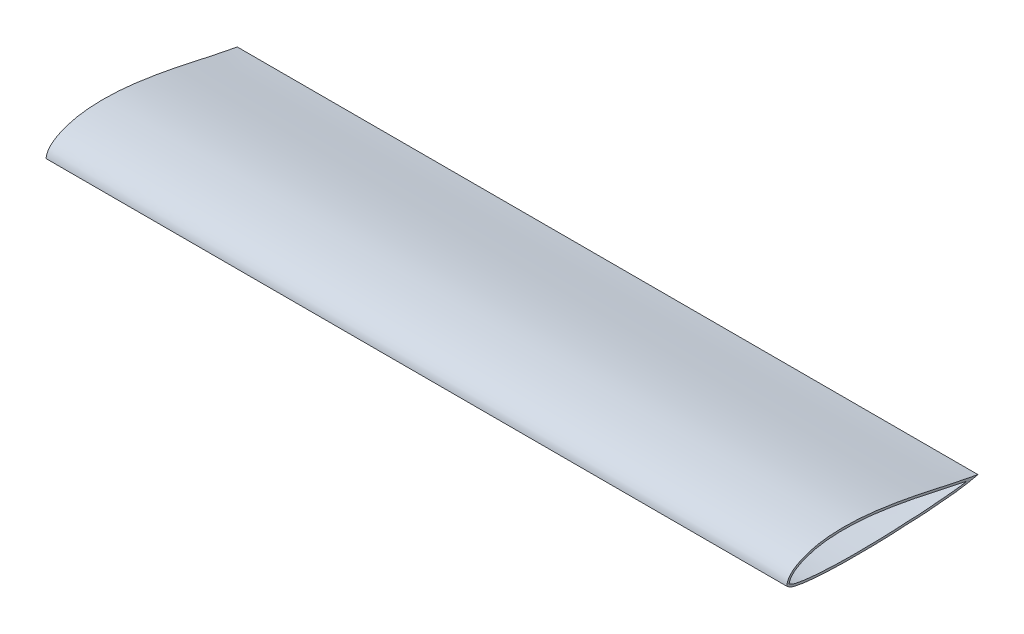
from build123d import *

# Parameters (mm, degrees)
BOSS_EXTRUDE1_DEPTH      = 1000
BOSS_EXTRUDE1_DEPTH_BACK = 1


with BuildPart() as part:
    # Эскиз1 → Boss-Extrude1 (new, two sides: drawn at the far end of the back side and taken through both)
    with BuildSketch(Plane(origin=(0, 0, 0), x_dir=(0, 0, -1), z_dir=(1, 0, 0)).offset(-BOSS_EXTRUDE1_DEPTH_BACK)):
        with BuildLine():
            add(Edge.make_bspline(
                [(-243.310683058, -1.150268376), (-243.229969159, -0.769695449), (-243.105270302, -0.185368277), (-242.953517188, 0.539863487), (-242.753390645, 1.444665693), (-242.456140174, 2.503129007), (-241.880344751, 4.147441349), (-240.986514665, 6.059139616), (-239.240565442, 8.830800971), (-236.588010137, 11.76475732), (-232.973058982, 14.612146661), (-229.222416024, 16.969906989), (-225.395647069, 19.096425705), (-221.307667343, 20.924677193), (-217.227780324, 22.380014372), (-213.172616695, 23.701432489), (-207.675279818, 25.302328207), (-200.662726553, 26.904170589), (-192.197880579, 28.173548143), (-180.902010238, 29.300779772), (-166.751895399, 29.775170115), (-149.84612089, 29.280901482), (-133.021765483, 27.976977395), (-116.267909512, 25.982090966), (-99.65305645, 23.381470424), (-83.119365112, 20.593484986), (-66.569940341, 17.423051082), (-50.196897147, 13.799131693), (-36.580965629, 10.888975639), (-25.653250319, 8.541163563), (-17.466043443, 6.728751925), (-9.308567048, 4.930315085), (-1.184151043, 3.255237568), (7.042695501, 1.724869581), (12.526262968, 0.678918583), (15.268171313, 0.159156294)],
                knots=[-0.006465526, -0.006465526, -0.006465526, -0.006465526, -0.002301315, -0.00021921, 0.001862895, 0.006027105, 0.010191315, 0.018519736, 0.026848157, 0.043504998, 0.060161839, 0.07681868, 0.093475521, 0.110132362, 0.126789204, 0.143446045, 0.160102886, 0.193416568, 0.226730251, 0.260043933, 0.326671298, 0.393298662, 0.459926027, 0.526553392, 0.593180757, 0.659808121, 0.726435486, 0.793062851, 0.859690215, 0.893003898, 0.92631758, 0.959631262, 0.992944945, 1.026258627, 1.059572309, 1.059572309, 1.059572309, 1.059572309], degree=3))
            add(Edge.make_bspline(
                [(15.268171313, 0.159156294), (12.631212345, -0.397894868), (8.678882015, -1.232806966), (4.056951533, -2.209197338), (1.431389016, -2.763811469), (-1.252191801, -3.330832305), (-4.647610554, -3.951771055), (-10.061887315, -4.789220721), (-16.83407052, -5.59459554), (-24.915421709, -6.344279579), (-32.964662436, -7.031875465), (-41.002501914, -7.707093841), (-48.997703739, -8.436974434), (-55.717360957, -9.113360777), (-61.151456045, -9.552027836), (-65.254308426, -9.795138265), (-68.696436438, -9.903987809), (-71.466897809, -9.900922023), (-74.068569263, -9.90945807), (-77.378533987, -10.001752024), (-82.675848926, -10.259088087), (-89.353331996, -10.730208543), (-97.47326399, -11.283168106), (-105.598117993, -11.630425686), (-116.395961347, -11.932924562), (-129.834671399, -12.232003681), (-146.030483639, -12.494181734), (-162.2359961, -12.400130504), (-175.730843126, -12.065189151), (-186.526679316, -11.63199485), (-194.614658124, -11.227059492), (-202.734870404, -10.713609654), (-209.503875729, -10.093479055), (-214.889667279, -9.508092261), (-218.917219851, -9.051373705), (-223.051507907, -8.483567548), (-226.435608536, -7.853955705), (-229.069092421, -7.35081147), (-231.107952771, -6.95564996), (-233.20494016, -6.481816044), (-235.336936227, -5.873632962), (-237.480526533, -5.067428987), (-239.249671592, -4.174176713), (-240.454666939, -3.409109593), (-241.134524109, -2.925124617), (-241.544427275, -2.611794324), (-241.888945063, -2.331749862), (-242.155147072, -2.109381089), (-242.633506164, -1.71297086), (-243.039240617, -1.375681478), (-243.310683058, -1.150268376)],
                knots=[-0.007148785, -0.007148785, -0.007148785, -0.007148785, 0.026257637, 0.042960849, 0.051312454, 0.05966406, 0.076367271, 0.093070483, 0.126476905, 0.159883328, 0.193289751, 0.226696173, 0.260102596, 0.293509018, 0.31021223, 0.326915441, 0.343618652, 0.351970258, 0.360321864, 0.377025075, 0.393728286, 0.427134709, 0.460541132, 0.493947554, 0.527353977, 0.594166822, 0.660979667, 0.727792513, 0.794605358, 0.828011781, 0.861418203, 0.894824626, 0.928231048, 0.94493426, 0.961637471, 0.978340682, 0.995043894, 1.003395499, 1.011747105, 1.020098711, 1.028450316, 1.036801922, 1.045153528, 1.049329331, 1.051417232, 1.053505133, 1.054549084, 1.055593035, 1.057680936, 1.061856739, 1.061856739, 1.061856739, 1.061856739], degree=3))
        make_face()
        with BuildLine():
            add(Edge.make_bspline(
                [(-240, 0), (-238.539586148, 6.885975956), (-231.6119689, 12.33782744), (-222.175332595, 17.412091216), (-214.111867769, 20.343482826), (-204.156129061, 23.263904239), (-188.104616678, 25.89332168), (-168.007150597, 26.960143982), (-143.945589986, 26.026388226), (-119.918298994, 23.567750867), (-95.953760008, 19.758812003), (-71.912657951, 15.561977026), (-48.005978392, 10.220578603), (-23.989791717, 5.171383231), (-8.037469261, 1.523600682), (0, 0)],
                knots=[0, 0, 0, 0, 0.075346011, 0.102327605, 0.127890212, 0.177564304, 0.226024831, 0.321726685, 0.417300323, 0.513304723, 0.609920295, 0.706973803, 0.804635001, 0.902346226, 1, 1, 1, 1], degree=3))
            add(Edge.make_bspline(
                [(-240, 0), (-236.52391179, -2.886637123), (-230.220810861, -4.067786061), (-222.028601874, -5.648779907), (-214.009642515, -6.608514015), (-204.019456847, -7.65058139), (-188.010543644, -8.621004369), (-168.008371033, -9.355028053), (-143.997445941, -9.544655848), (-119.996434598, -9.000571646), (-95.984120714, -8.452313319), (-79.444451482, -6.861549256), (-63.412851028, -6.941357818), (-47.421480018, -5.149296578), (-23.951991061, -3.34616289), (-7.916011456, -1.672238148), (0, 0)],
                knots=[0, 0, 0, 0, 0.053475274, 0.07870931, 0.103753204, 0.153672751, 0.203448049, 0.302856431, 0.40219897, 0.501554025, 0.600954522, 0.700430481, 0.707480416, 0.799996455, 0.899715685, 1, 1, 1, 1], degree=3))
        make_face(mode=Mode.SUBTRACT)
    extrude(amount=BOSS_EXTRUDE1_DEPTH + BOSS_EXTRUDE1_DEPTH_BACK)


solid = part.part
